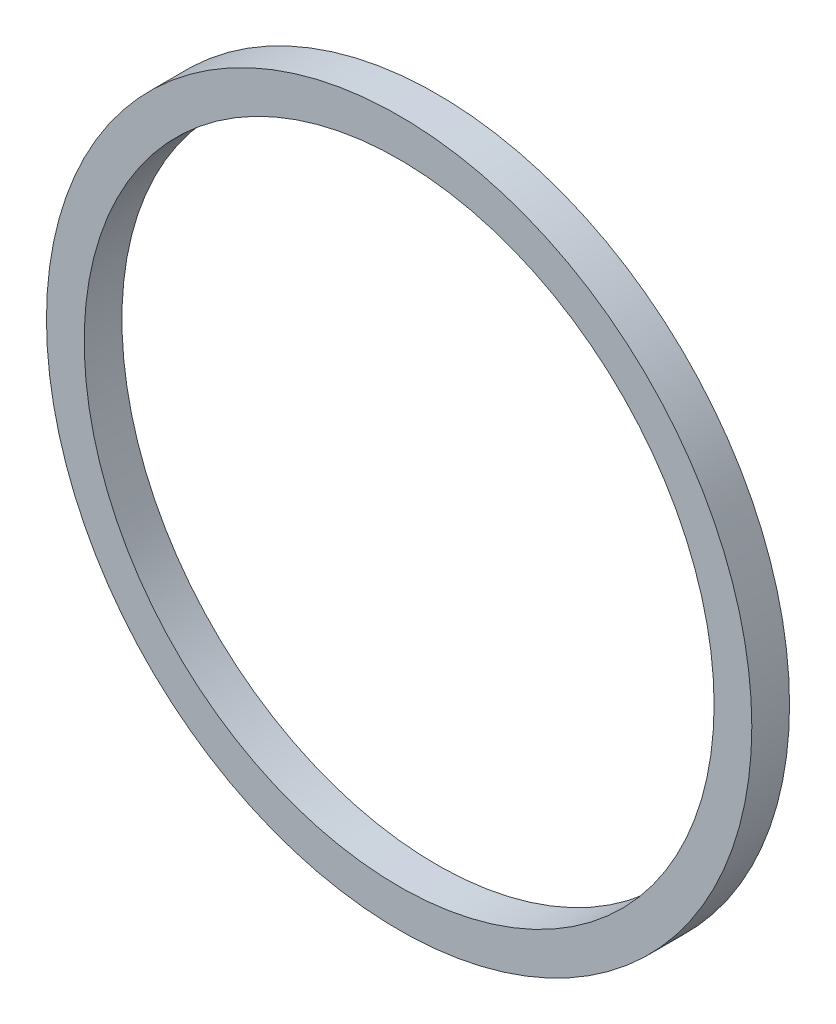
from build123d import *

# Parameters (mm, degrees)
SKETCH1_R           = 23.749
SKETCH1_R_2         = 21.209
BOSS_EXTRUDE1_DEPTH = 2.54


with BuildPart() as part:
    # Sketch1 → Boss-Extrude1 (new body)
    with BuildSketch(Plane.XY):
        Circle(SKETCH1_R)
        Circle(SKETCH1_R_2, mode=Mode.SUBTRACT)
    extrude(amount=BOSS_EXTRUDE1_DEPTH)


solid = part.part
